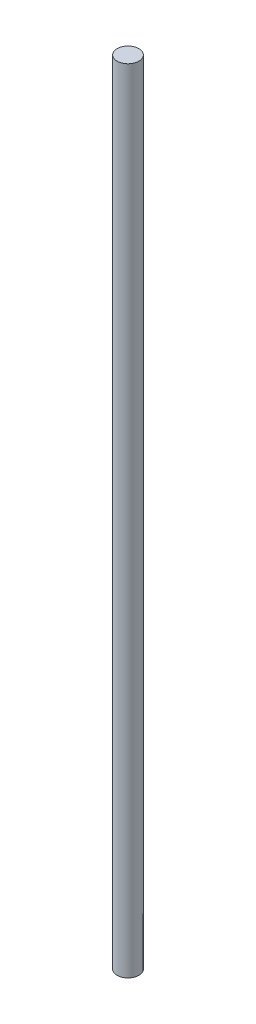
from build123d import *

# Parameters (mm, degrees)
SKETCH_1_R      = 11
EXTRUDE_1_DEPTH = 800


with BuildPart() as part:
    # 草图1 → 凸台-拉伸1 (new body)
    with BuildSketch(Plane(origin=(0, 0, 0), x_dir=(1, 0, 0), z_dir=(0, 1, 0))):
        with Locations(Location((0, 0, 0), (0, 0, 270))):
            Circle(SKETCH_1_R)
    extrude(amount=EXTRUDE_1_DEPTH)


solid = part.part
